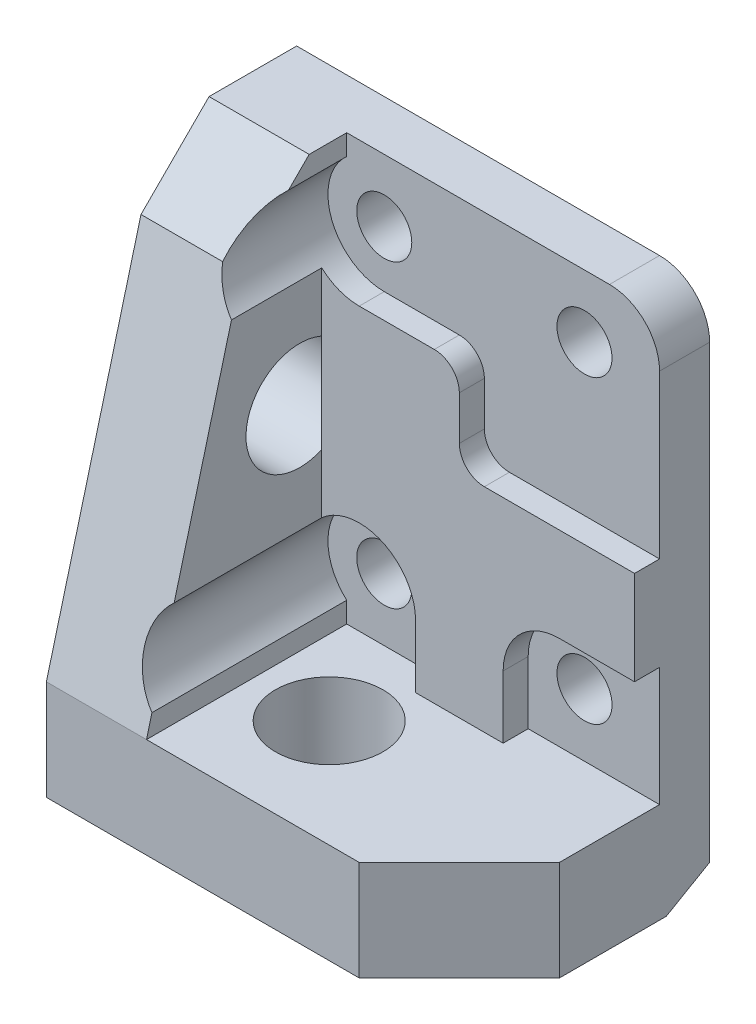
from build123d import *

# Parameters (mm, degrees)
SKETCH_1_W               = 23
SKETCH_1_H               = 17
SKETCH_1_R               = 1.1
EXTRUDE_1_DEPTH          = 3
EXTRUDE_2_DEPTH          = 6
CUT_EXTRUDE_1_DEPTH      = 23.349496639
CUT_EXTRUDE_1_DEPTH_BACK = 1
SKETCH_3_R               = 2.25
CUT_EXTRUDE_2_REACH      = 24.349
SKETCH_4_W               = 4.5
SKETCH_4_H               = 17
CUT_EXTRUDE_3_DEPTH      = 2
SKETCH_6_R               = 2.15
CUT_EXTRUDE_4_DEPTH      = 4
SKETCH_7_W               = 16.5
SKETCH_7_H               = 10
EXTRUDE_3_DEPTH          = 4
SKETCH_8_R               = 2.15
CUT_EXTRUDE_5_DEPTH      = 4
CHAMFER_1_SIZE           = 1
CHAMFER_1_SIZE2          = 1.732050808
CHAMFER_2_SIZE           = 4
CUT_EXTRUDE_6_DEPTH      = 1
FILLET_1_R               = 2
CUT_EXTRUDE_7_REACH      = 21.881
FILLET_2_R               = 1
CHAMFER_3_SIZE           = 2
CHAMFER_3_SIZE2          = 2.813680863


with BuildPart() as part:
    # 草图1 → 凸台-拉伸1 (new body)
    with BuildSketch(Plane.XY):
        with Locations((4, 6)):
            Rectangle(SKETCH_1_W, SKETCH_1_H)
        Circle(SKETCH_1_R, mode=Mode.SUBTRACT)
        with Locations((8, 0)):
            Circle(SKETCH_1_R, mode=Mode.SUBTRACT)
        with Locations((0, 12)):
            Circle(SKETCH_1_R, mode=Mode.SUBTRACT)
        with Locations((8, 12)):
            Circle(SKETCH_1_R, mode=Mode.SUBTRACT)
    extrude(amount=EXTRUDE_1_DEPTH)

    # 草图2 → 凸台-拉伸2 (add)
    with BuildSketch(Plane.ZY.offset(7.5)):
        Polygon((5.5, 14.5), (10, -2.5), (5.5, -2.5), (0, -2.5), (0, 14.5), align=None)
    extrude(amount=-EXTRUDE_2_DEPTH)

    # 草图3 → 切除-拉伸1 (cut, two sides: drawn at the far end of the back side and taken through both)
    with BuildSketch(Plane.XY.offset(3).offset(-CUT_EXTRUDE_1_DEPTH_BACK)):
        with Locations(Location((0, 12, 0), (0, 0, 228.189685104))):
            Circle(SKETCH_3_R)
        with Locations((8, 12)):
            Circle(SKETCH_3_R)
        with Locations(Location((0, 0, 0), (0, 0, 131.810314896))):
            Circle(SKETCH_3_R)
        with Locations((8, 0)):
            Circle(SKETCH_3_R)
    extrude(amount=CUT_EXTRUDE_1_DEPTH + CUT_EXTRUDE_1_DEPTH_BACK, mode=Mode.SUBTRACT)

    # 草图4 → 切除-拉伸2 (cut, up to next)
    with BuildSketch(Plane.XY.offset(3), mode=Mode.PRIVATE) as cut_extrude_2_sk1:
        with Locations((13.25, 6)):
            Rectangle(SKETCH_4_W, SKETCH_4_H)
    cut_extrude_2_tool1 = extrude(cut_extrude_2_sk1.sketch, amount=-CUT_EXTRUDE_2_REACH, mode=Mode.PRIVATE) & part.part
    add(cut_extrude_2_tool1.solids().sort_by_distance((13.25, 6, 3))[0], mode=Mode.SUBTRACT)

    # 草图5 → 切除-拉伸3 (cut)
    with BuildSketch(Plane.ZY.offset(7.5)):
        Polygon((0, 14.5), (0, -2.5), (10, -2.5), (5.5, 14.5), align=None)
    extrude(amount=-CUT_EXTRUDE_3_DEPTH, mode=Mode.SUBTRACT)

    # 草图6 → 切除-拉伸4 (cut)
    with BuildSketch(Plane.ZY.offset(5.5)):
        with Locations(Location((3.875, 6, 0), (0, 0, 270))):
            Circle(SKETCH_6_R)
    extrude(amount=-CUT_EXTRUDE_4_DEPTH, mode=Mode.SUBTRACT)

    # 草图7 → 凸台-拉伸3 (add)
    with BuildSketch(Plane.XZ.offset(2.5)):
        with Locations((2.75, 5)):
            Rectangle(SKETCH_7_W, SKETCH_7_H)
    extrude(amount=EXTRUDE_3_DEPTH)

    # 草图8 → 切除-拉伸5 (cut)
    with BuildSketch(Plane.XZ.offset(6.5)):
        with Locations(Location((1.5, 5.7, 0), (0, 0, 270))):
            Circle(SKETCH_8_R)
    extrude(amount=-CUT_EXTRUDE_5_DEPTH, mode=Mode.SUBTRACT)

    # 倒角1
    chamfer_1_edges = [part.edges().sort_by_distance(p)[0] for p in [
        (2.75, -6.5, 0),
    ]]
    chamfer_1_side = [part.faces().sort_by_distance(p)[0] for p in [
        (2.692629218, 3.908206749, 0),
    ]]
    chamfer(chamfer_1_edges, length=CHAMFER_1_SIZE, length2=CHAMFER_1_SIZE2, reference=chamfer_1_side[0])

    # 倒角2
    chamfer_2_edges = [part.edges().sort_by_distance(p)[0] for p in [
        (11, -4.5, 10),
    ]]
    chamfer(chamfer_2_edges, length=CHAMFER_2_SIZE)

    # 草图9 → 切除-拉伸6 (cut)
    with BuildSketch(Plane.XY.offset(3)):
        with BuildLine():
            Line((-1.5, 13.677050983), (-1.5, 14.5))
            Line((-1.5, 14.5), (2.25, 14.5))
            Line((2.25, 14.5), (2.25, 12))
            ThreePointArc((2.25, 12), (0.918558654, 14.053959591), (-1.5, 13.677050983))
        make_face()
        with BuildLine():
            Line((5.75, 12), (5.75, 14.5))
            Line((5.75, 14.5), (11, 14.5))
            Line((11, 14.5), (11, 9.75))
            Line((11, 9.75), (8, 9.75))
            ThreePointArc((8, 9.75), (9.590990258, 13.590990258), (5.75, 12))
        make_face()
        with BuildLine():
            Line((2.25, 0), (2.25, -2.5))
            Line((2.25, -2.5), (-1.5, -2.5))
            Line((-1.5, -2.5), (-1.5, -1.677050983))
            ThreePointArc((-1.5, -1.677050983), (0.918558654, -2.053959591), (2.25, 0))
        make_face()
        with BuildLine():
            Line((5.75, 0), (5.75, -2.5))
            Line((5.75, -2.5), (11, -2.5))
            Line((11, -2.5), (11, 2.25))
            Line((11, 2.25), (8, 2.25))
            ThreePointArc((8, 2.25), (9.590990258, -1.590990258), (5.75, 0))
        make_face()
    extrude(amount=-CUT_EXTRUDE_6_DEPTH, mode=Mode.SUBTRACT)

    # 圆角1
    fillet_1_edges = [part.edges().sort_by_distance(p)[0] for p in [
        (11, 14.5, 1),
    ]]
    fillet(fillet_1_edges, radius=FILLET_1_R)

    # 草图10 → 切除-拉伸7 (cut, up to next)
    with BuildSketch(Plane.XY.offset(2), mode=Mode.PRIVATE) as cut_extrude_7_sk1:
        with BuildLine():
            Line((4, 14.5), (11, 14.5))
            Line((11, 14.5), (11, 6))
            Line((11, 6), (4, 6))
            Line((4, 6), (4, 9.75))
            Line((4, 9.75), (0, 9.75))
            ThreePointArc((0, 9.75), (1.590990258, 10.409009742), (2.25, 12))
            Line((2.25, 12), (2.25, 14.5))
            Line((2.25, 14.5), (4, 14.5))
        make_face()
    cut_extrude_7_tool1 = extrude(cut_extrude_7_sk1.sketch, amount=CUT_EXTRUDE_7_REACH, mode=Mode.PRIVATE) & part.part
    add(cut_extrude_7_tool1.solids().sort_by_distance((6.881457, 10.476255, 2))[0], mode=Mode.SUBTRACT)

    # 圆角2
    fillet_2_edges = [part.edges().sort_by_distance(p)[0] for p in [
        (4, 9.75, 2.5),
        (4, 6, 2.5),
    ]]
    fillet(fillet_2_edges, radius=FILLET_2_R)

    # 倒角3
    chamfer_3_edges = [part.edges().sort_by_distance(p)[0] for p in [
        (-3.5, 14.5, 5.5),
    ]]
    chamfer_3_side = [part.faces().sort_by_distance(p)[0] for p in [
        (0.040697674, 14.5, 1.895348837),
    ]]
    chamfer(chamfer_3_edges, length=CHAMFER_3_SIZE, length2=CHAMFER_3_SIZE2, reference=chamfer_3_side[0])


solid = part.part
